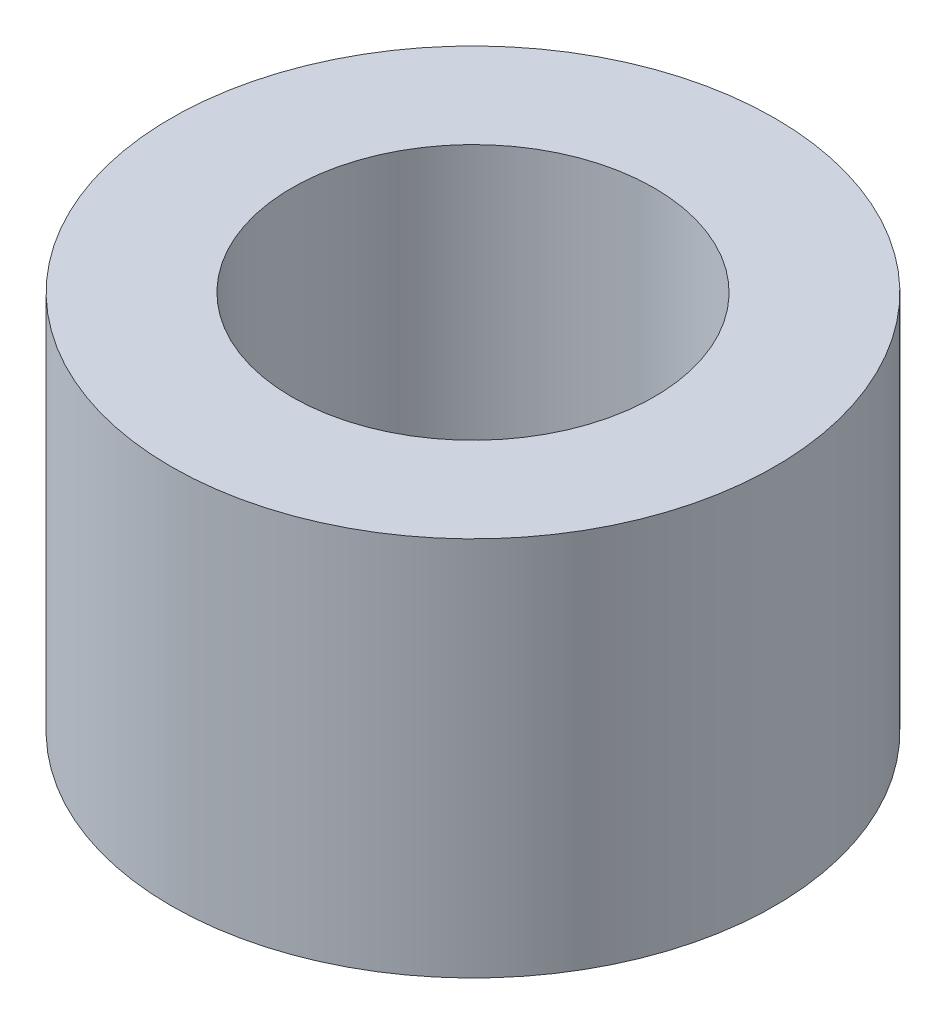
from build123d import *

# Parameters (mm, degrees)
CROQUIS_BASE_R          = 2.5
SALIENTE_EXTRUIR1_DEPTH = 3.15
CROQUIS_BARRENOS_R      = 1.5
CORTAR_EXTRUIR1_DEPTH   = 5.735240226


with BuildPart() as part:
    # Croquis base → Saliente-Extruir1 (new body)
    with BuildSketch(Plane(origin=(0, 0, 0), x_dir=(1, 0, 0), z_dir=(0, 1, 0))):
        with Locations(Location((0, 0, 0), (0, 0, 270))):
            Circle(CROQUIS_BASE_R)
    extrude(amount=SALIENTE_EXTRUIR1_DEPTH)

    # Croquis barrenos → Cortar-Extruir1 (cut, through all)
    with BuildSketch(Plane(origin=(0, 3.15, 0), x_dir=(1, 0, 0), z_dir=(0, 1, 0))):
        with Locations(Location((0, 0, 0), (0, 0, 270))):
            Circle(CROQUIS_BARRENOS_R)
    extrude(amount=-CORTAR_EXTRUIR1_DEPTH, mode=Mode.SUBTRACT)


solid = part.part
